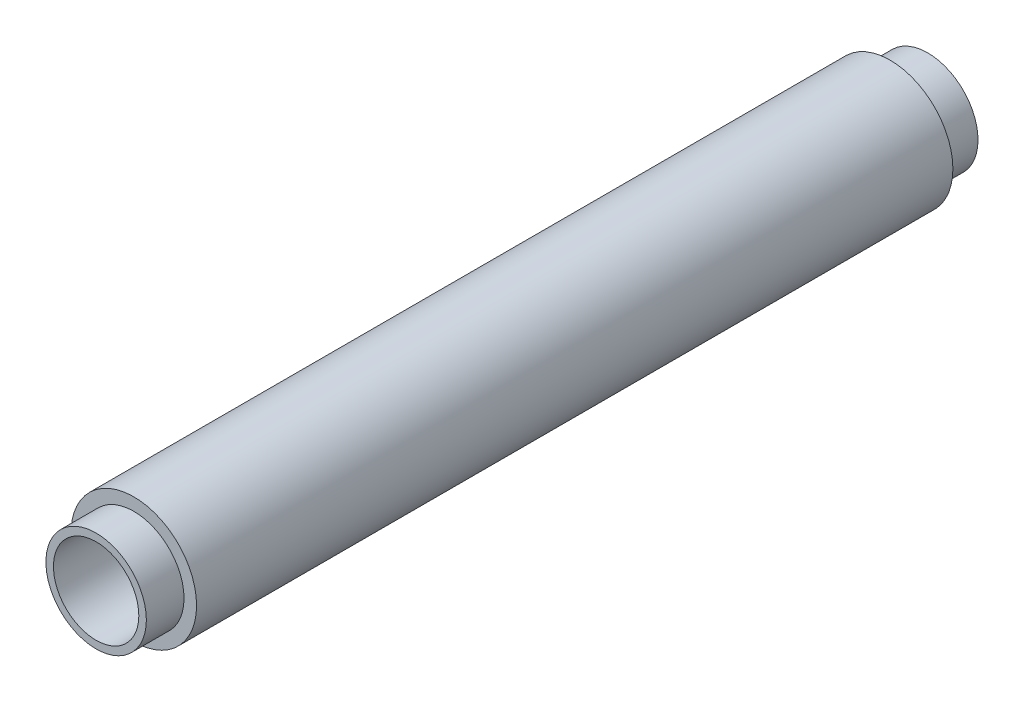
from build123d import *


with BuildPart() as part:
    # Эскиз1 → Повернуть1 (revolve)
    with BuildSketch(Plane(origin=(0, 0, 0), x_dir=(1, 0, 0), z_dir=(0, 1, 0)), mode=Mode.PRIVATE) as revolve_1_sk:
        Polygon((-25, 0), (-17, 0), (-17, -165.6), (-20, -165.6), (-20, -150.6), (-25, -150.6), align=None)
    revolve_1 = revolve(revolve_1_sk.sketch.rotate(Axis((0, 0, 1000), (0, 0, -1)), 180), axis=Axis((0, 0, 1000), (0, 0, -1)))

    # Зеркальное отражение1: Повернуть1 across plane
    add(revolve_1.mirror(Plane(origin=(-25, 0, 0), x_dir=(1, 0, 0), z_dir=(0, 0, 1))))


solid = part.part
